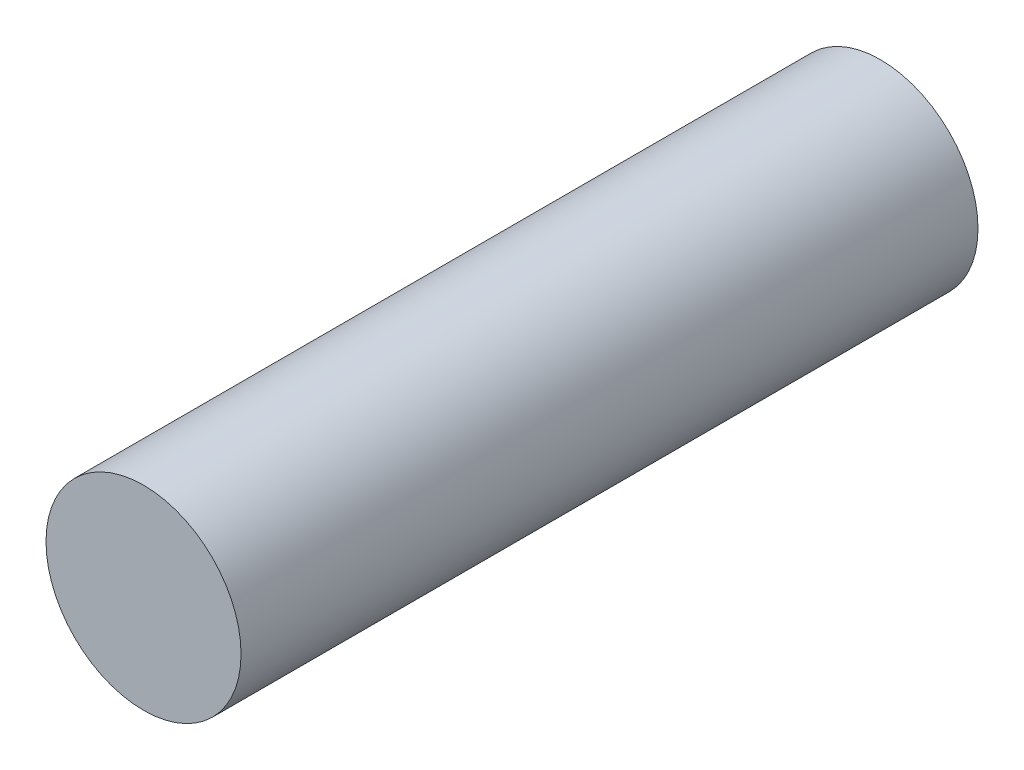
from build123d import *

# Parameters (mm, degrees)
SKETCH_1_R      = 7.94
EXTRUDE_2_DEPTH = 60


with BuildPart() as part:
    # 草图1 → 凸台-拉伸2 (new body)
    with BuildSketch(Plane.XY):
        Circle(SKETCH_1_R)
    extrude(amount=EXTRUDE_2_DEPTH)


solid = part.part
